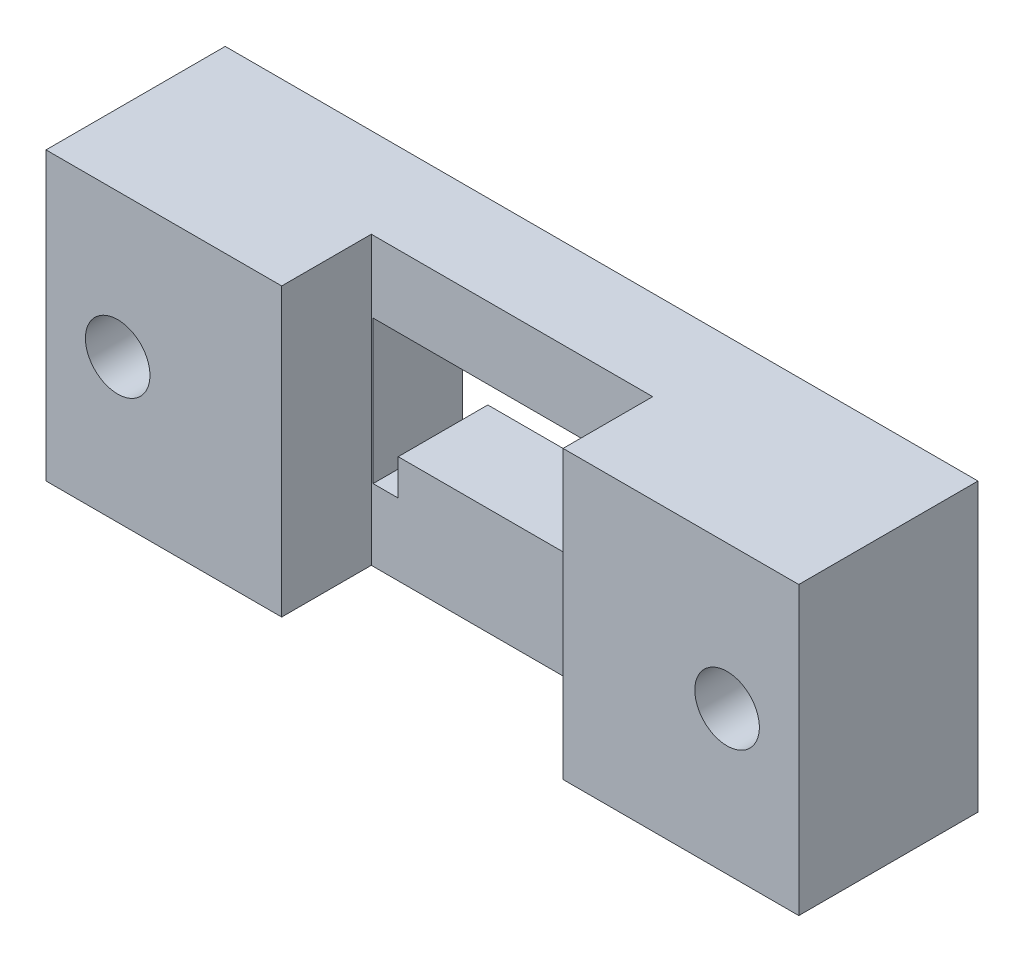
from build123d import *

# Parameters (mm, degrees)
SKETCH_1_W                   = 42
SKETCH_1_H                   = 16
EXTRUDE_1_DEPTH              = 10
CUT_EXTRUDE_1_DEPTH          = 47.043457733
SKETCH_4_W                   = 15.7
SKETCH_4_H                   = 16
CUT_EXTRUDE_2_DEPTH          = 5
HOLE_WIZARD_M3_1_D           = 3.6
HOLE_WIZARD_M3_1_CBORE_D     = 6.5
HOLE_WIZARD_M3_1_CBORE_DEPTH = 3


with BuildPart() as part:
    # 草图1 → 凸台-拉伸1 (new body)
    with BuildSketch(Plane.XY):
        with Locations((21, 8)):
            Rectangle(SKETCH_1_W, SKETCH_1_H)
    extrude(amount=EXTRUDE_1_DEPTH)

    # 草图2 → 切除-拉伸1 (cut, through all)
    with BuildSketch(Plane.XY.offset(10)):
        Polygon((28.75, 12), (13.25, 12), (13.25, 4), (14.65, 4), (14.65, 6), (27.35, 6), (27.35, 4), (28.75, 4), align=None)
    extrude(amount=-CUT_EXTRUDE_1_DEPTH, mode=Mode.SUBTRACT)

    # 草图4 → 切除-拉伸2 (cut)
    with BuildSketch(Plane.XY.offset(10)):
        with Locations((21, 8)):
            Rectangle(SKETCH_4_W, SKETCH_4_H)
    extrude(amount=-CUT_EXTRUDE_2_DEPTH, mode=Mode.SUBTRACT)

    # M3 六角凹头螺钉的柱形沉头孔1 (through all)
    with Locations(Plane(origin=(0, 0, 0), x_dir=(-1, 0, 0), z_dir=(0, 0, -1))):
        with Locations((-38, 8), (-4, 8)):
            CounterBoreHole(HOLE_WIZARD_M3_1_D / 2, HOLE_WIZARD_M3_1_CBORE_D / 2, HOLE_WIZARD_M3_1_CBORE_DEPTH)


solid = part.part
